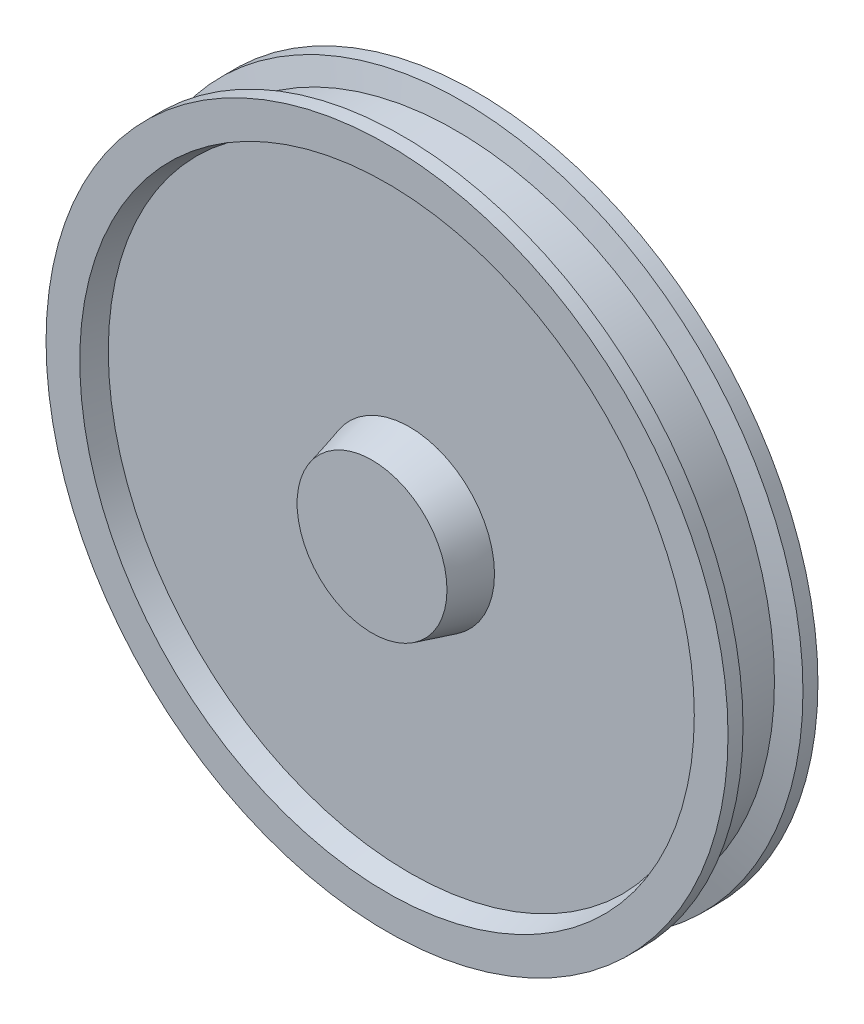
from build123d import *


with BuildPart() as part:
    # Sketch1 → Revolve1 (revolve)
    with BuildSketch(Plane(origin=(0, 0, 0), x_dir=(0, 0, -1), z_dir=(1, 0, 0)), mode=Mode.PRIVATE) as revolve1_sk:
        Polygon((-80, 0), (80, 0), (80, 100), (30, 113.397459622), (30, 401.961524227), (60, 410), (60, 455), (40, 455), (31.961524227, 425), (-31.961524227, 425), (-40, 455), (-60, 455), (-60, 410), (-30, 401.961524227), (-30, 113.397459622), (-80, 100), align=None)
    revolve(revolve1_sk.sketch.rotate(Axis((0, 0, 1000), (0, 0, -1)), 90), axis=Axis((0, 0, 1000), (0, 0, -1)))


solid = part.part
